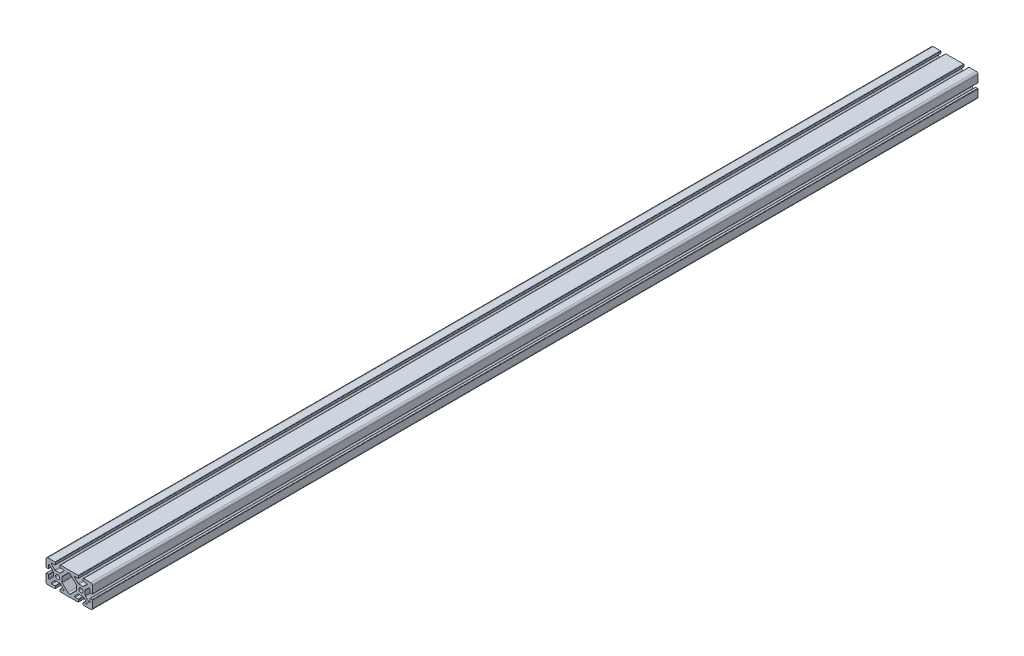
from build123d import *

# Parameters (mm, degrees)
SKETCH3_R           = 3.5
BOSS_EXTRUDE1_DEPTH = 762


with BuildPart() as part:
    # Sketch3 → Boss-Extrude1 (new, symmetric)
    with BuildSketch(Plane.XY):
        with BuildLine():
            Line((15.25, 20), (-15.25, 20))
            ThreePointArc((-15.25, 20), (-15.780330086, 19.780330086), (-16, 19.25))
            Line((-16, 19.25), (-16, 16.25))
            ThreePointArc((-16, 16.25), (-15.780330086, 15.719669914), (-15.25, 15.5))
            Line((-15.25, 15.5), (-9.931980515, 15.5))
            ThreePointArc((-9.931980515, 15.5), (-9.070942793, 14.924672987), (-9.272970773, 13.909009742))
            Line((-9.272970773, 13.909009742), (-15.140128061, 8.041852455))
            ThreePointArc((-15.140128061, 8.041852455), (-15.740311256, 7.640822865), (-16.448275606, 7.5))
            Line((-16.448275606, 7.5), (-23.551724394, 7.5))
            ThreePointArc((-23.551724394, 7.5), (-24.259688744, 7.640822865), (-24.859871939, 8.041852455))
            Line((-24.859871939, 8.041852455), (-30.727029227, 13.909009742))
            ThreePointArc((-30.727029227, 13.909009742), (-30.929057207, 14.924672987), (-30.068019485, 15.5))
            Line((-30.068019485, 15.5), (-24.75, 15.5))
            ThreePointArc((-24.75, 15.5), (-24.219669914, 15.719669914), (-24, 16.25))
            Line((-24, 16.25), (-24, 19.25))
            ThreePointArc((-24, 19.25), (-24.219669914, 19.780330086), (-24.75, 20))
            Line((-24.75, 20), (-37, 20))
            ThreePointArc((-37, 20), (-39.121320344, 19.121320344), (-40, 17))
            Line((-40, 17), (-40, 4.75))
            ThreePointArc((-40, 4.75), (-39.780330086, 4.219669914), (-39.25, 4))
            Line((-39.25, 4), (-36.25, 4))
            ThreePointArc((-36.25, 4), (-35.719669914, 4.219669914), (-35.5, 4.75))
            Line((-35.5, 4.75), (-35.5, 10.068019485))
            ThreePointArc((-35.5, 10.068019485), (-34.924672987, 10.929057207), (-33.909009742, 10.727029227))
            Line((-33.909009742, 10.727029227), (-28.041852455, 4.859871939))
            ThreePointArc((-28.041852455, 4.859871939), (-27.640822865, 4.259688744), (-27.5, 3.551724394))
            Line((-27.5, 3.551724394), (-27.5, -3.551724394))
            ThreePointArc((-27.5, -3.551724394), (-27.640822865, -4.259688744), (-28.041852455, -4.859871939))
            Line((-28.041852455, -4.859871939), (-33.909009742, -10.727029227))
            ThreePointArc((-33.909009742, -10.727029227), (-34.924672987, -10.929057207), (-35.5, -10.068019485))
            Line((-35.5, -10.068019485), (-35.5, -4.75))
            ThreePointArc((-35.5, -4.75), (-35.719669914, -4.219669914), (-36.25, -4))
            Line((-36.25, -4), (-39.25, -4))
            ThreePointArc((-39.25, -4), (-39.780330086, -4.219669914), (-40, -4.75))
            Line((-40, -4.75), (-40, -17))
            ThreePointArc((-40, -17), (-39.121320344, -19.121320344), (-37, -20))
            Line((-37, -20), (-24.75, -20))
            ThreePointArc((-24.75, -20), (-24.219669914, -19.780330086), (-24, -19.25))
            Line((-24, -19.25), (-24, -16.25))
            ThreePointArc((-24, -16.25), (-24.219669914, -15.719669914), (-24.75, -15.5))
            Line((-24.75, -15.5), (-30.068019485, -15.5))
            ThreePointArc((-30.068019485, -15.5), (-30.929057207, -14.924672987), (-30.727029227, -13.909009742))
            Line((-30.727029227, -13.909009742), (-24.859871939, -8.041852455))
            ThreePointArc((-24.859871939, -8.041852455), (-24.259688744, -7.640822865), (-23.551724394, -7.5))
            Line((-23.551724394, -7.5), (-16.448275606, -7.5))
            ThreePointArc((-16.448275606, -7.5), (-15.740311256, -7.640822865), (-15.140128061, -8.041852455))
            Line((-15.140128061, -8.041852455), (-9.272970773, -13.909009742))
            ThreePointArc((-9.272970773, -13.909009742), (-9.070942793, -14.924672987), (-9.931980515, -15.5))
            Line((-9.931980515, -15.5), (-15.25, -15.5))
            ThreePointArc((-15.25, -15.5), (-15.780330086, -15.719669914), (-16, -16.25))
            Line((-16, -16.25), (-16, -19.25))
            ThreePointArc((-16, -19.25), (-15.780330086, -19.780330086), (-15.25, -20))
            Line((-15.25, -20), (15.25, -20))
            ThreePointArc((15.25, -20), (15.780330086, -19.780330086), (16, -19.25))
            Line((16, -19.25), (16, -16.25))
            ThreePointArc((16, -16.25), (15.780330086, -15.719669914), (15.25, -15.5))
            Line((15.25, -15.5), (9.931980515, -15.5))
            ThreePointArc((9.931980515, -15.5), (9.070942793, -14.924672987), (9.272970773, -13.909009742))
            Line((9.272970773, -13.909009742), (15.140128061, -8.041852455))
            ThreePointArc((15.140128061, -8.041852455), (15.740311256, -7.640822865), (16.448275606, -7.5))
            Line((16.448275606, -7.5), (23.551724394, -7.5))
            ThreePointArc((23.551724394, -7.5), (24.259688744, -7.640822865), (24.859871939, -8.041852455))
            Line((24.859871939, -8.041852455), (30.727029227, -13.909009742))
            ThreePointArc((30.727029227, -13.909009742), (30.929057207, -14.924672987), (30.068019485, -15.5))
            Line((30.068019485, -15.5), (24.75, -15.5))
            ThreePointArc((24.75, -15.5), (24.219669914, -15.719669914), (24, -16.25))
            Line((24, -16.25), (24, -19.25))
            ThreePointArc((24, -19.25), (24.219669914, -19.780330086), (24.75, -20))
            Line((24.75, -20), (37, -20))
            ThreePointArc((37, -20), (39.121320344, -19.121320344), (40, -17))
            Line((40, -17), (40, -4.75))
            ThreePointArc((40, -4.75), (39.780330086, -4.219669914), (39.25, -4))
            Line((39.25, -4), (36.25, -4))
            ThreePointArc((36.25, -4), (35.719669914, -4.219669914), (35.5, -4.75))
            Line((35.5, -4.75), (35.5, -10.068019485))
            ThreePointArc((35.5, -10.068019485), (34.924672987, -10.929057207), (33.909009742, -10.727029227))
            Line((33.909009742, -10.727029227), (28.041852455, -4.859871939))
            ThreePointArc((28.041852455, -4.859871939), (27.640822865, -4.259688744), (27.5, -3.551724394))
            Line((27.5, -3.551724394), (27.5, 3.551724394))
            ThreePointArc((27.5, 3.551724394), (27.640822865, 4.259688744), (28.041852455, 4.859871939))
            Line((28.041852455, 4.859871939), (33.909009742, 10.727029227))
            ThreePointArc((33.909009742, 10.727029227), (34.924672987, 10.929057207), (35.5, 10.068019485))
            Line((35.5, 10.068019485), (35.5, 4.75))
            ThreePointArc((35.5, 4.75), (35.719669914, 4.219669914), (36.25, 4))
            Line((36.25, 4), (39.25, 4))
            ThreePointArc((39.25, 4), (39.780330086, 4.219669914), (40, 4.75))
            Line((40, 4.75), (40, 17))
            ThreePointArc((40, 17), (39.121320344, 19.121320344), (37, 20))
            Line((37, 20), (24.75, 20))
            ThreePointArc((24.75, 20), (24.219669914, 19.780330086), (24, 19.25))
            Line((24, 19.25), (24, 16.25))
            ThreePointArc((24, 16.25), (24.219669914, 15.719669914), (24.75, 15.5))
            Line((24.75, 15.5), (30.068019485, 15.5))
            ThreePointArc((30.068019485, 15.5), (30.929057207, 14.924672987), (30.727029227, 13.909009742))
            Line((30.727029227, 13.909009742), (24.859871939, 8.041852455))
            ThreePointArc((24.859871939, 8.041852455), (24.259688744, 7.640822865), (23.551724394, 7.5))
            Line((23.551724394, 7.5), (16.448275606, 7.5))
            ThreePointArc((16.448275606, 7.5), (15.740311256, 7.640822865), (15.140128061, 8.041852455))
            Line((15.140128061, 8.041852455), (9.272970773, 13.909009742))
            ThreePointArc((9.272970773, 13.909009742), (9.070942793, 14.924672987), (9.931980515, 15.5))
            Line((9.931980515, 15.5), (15.25, 15.5))
            ThreePointArc((15.25, 15.5), (15.780330086, 15.719669914), (16, 16.25))
            Line((16, 16.25), (16, 19.25))
            ThreePointArc((16, 19.25), (15.780330086, 19.780330086), (15.25, 20))
        make_face()
        with Locations((-20, 0)):
            Circle(SKETCH3_R, mode=Mode.SUBTRACT)
        with Locations(Location((20, 0, 0), (0, 0, 180))):
            Circle(SKETCH3_R, mode=Mode.SUBTRACT)
        with BuildLine():
            Line((-2.25, -14.568019485), (-11.958147545, -4.859871939))
            ThreePointArc((-11.958147545, -4.859871939), (-12.359177135, -4.259688744), (-12.5, -3.551724394))
            Line((-12.5, -3.551724394), (-12.5, 3.551724394))
            ThreePointArc((-12.5, 3.551724394), (-12.359177135, 4.259688744), (-11.958147545, 4.859871939))
            Line((-11.958147545, 4.859871939), (-2.25, 14.568019485))
            ThreePointArc((-2.25, 14.568019485), (0, 15.5), (2.25, 14.568019485))
            Line((2.25, 14.568019485), (11.958147545, 4.859871939))
            ThreePointArc((11.958147545, 4.859871939), (12.359177135, 4.259688744), (12.5, 3.551724394))
            Line((12.5, 3.551724394), (12.5, -3.551724394))
            ThreePointArc((12.5, -3.551724394), (12.359177135, -4.259688744), (11.958147545, -4.859871939))
            Line((11.958147545, -4.859871939), (2.25, -14.568019485))
            ThreePointArc((2.25, -14.568019485), (0, -15.5), (-2.25, -14.568019485))
        make_face(mode=Mode.SUBTRACT)
    extrude(amount=BOSS_EXTRUDE1_DEPTH, both=True)


solid = part.part
